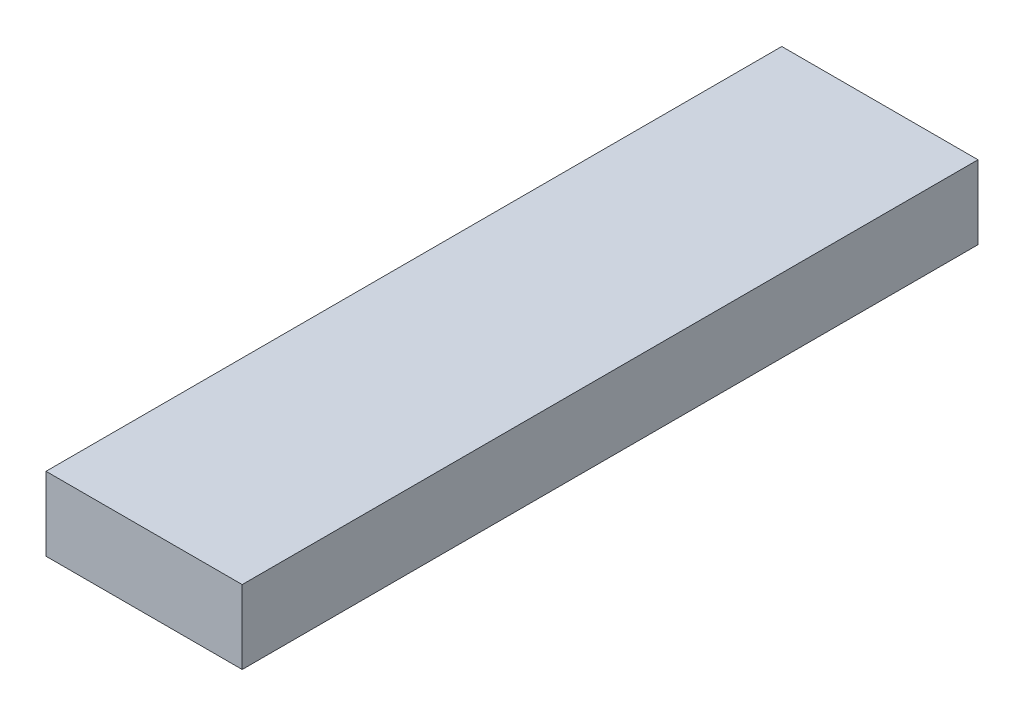
from build123d import *

# Parameters (mm, degrees)
SKETCH1_W           = 25.4
SKETCH1_H           = 9.525
BOSS_EXTRUDE1_DEPTH = 95.25


with BuildPart() as part:
    # Sketch1 → Boss-Extrude1 (new body)
    with BuildSketch(Plane.XY):
        with Locations((12.7, 4.7625)):
            Rectangle(SKETCH1_W, SKETCH1_H)
    extrude(amount=BOSS_EXTRUDE1_DEPTH)


solid = part.part
